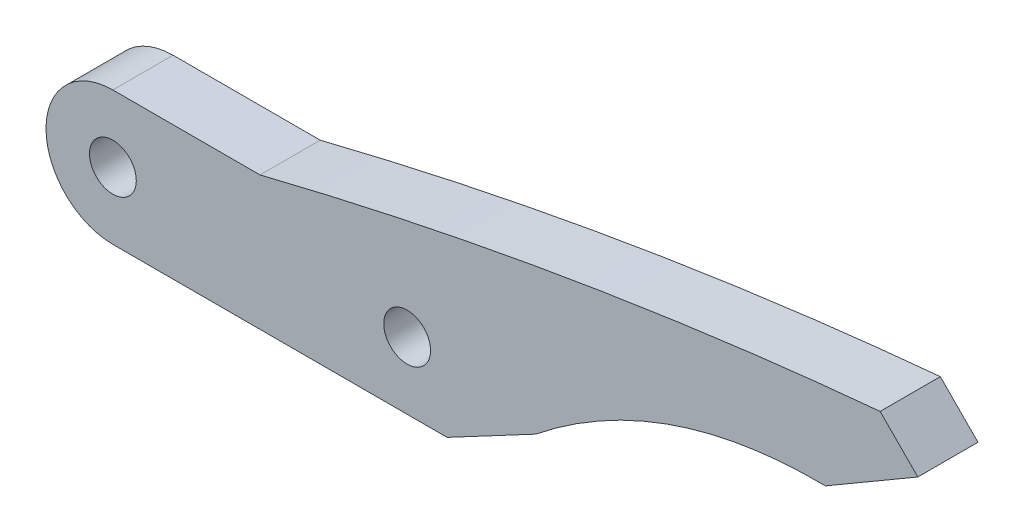
from build123d import *

# Parameters (mm, degrees)
SKETCH1_R           = 5
SKETCH1_R_2         = 1.75
BOSS_EXTRUDE1_DEPTH = 4.5
BOSS_EXTRUDE2_START = -4.5
BOSS_EXTRUDE2_DEPTH = 4.5


with BuildPart() as part:
    # Sketch1 → Boss-Extrude1 (new body)
    # profile 1 of 3: a face of its own
    with BuildSketch(Plane.XY):
        with Locations((-11, 0)):
            Circle(SKETCH1_R)
        with Locations((-11, 0)):
            Circle(SKETCH1_R_2, mode=Mode.SUBTRACT)
    # profile 2 of 3: a face of its own
    with BuildSketch(Plane.XY):
        with Locations((11, 0)):
            Circle(SKETCH1_R)
        with Locations((11, 0)):
            Circle(SKETCH1_R_2, mode=Mode.SUBTRACT)
    # profile 3 of 3: a face of its own
    with BuildSketch(Plane.XY):
        with BuildLine():
            ThreePointArc((-6, 0), (-7.464466094, -3.535533906), (-11, -5))
            Line((-11, -5), (11.000000019, -5))
            ThreePointArc((11.000000019, -5), (6, -9e-09), (11, 5))
            Line((11, 5), (-11, 5))
            ThreePointArc((-11, 5), (-7.464466094, 3.535533906), (-6, 0))
        make_face()
    extrude(amount=BOSS_EXTRUDE1_DEPTH)

    # Sketch2 → Boss-Extrude2 (add)
    with BuildSketch(Plane.XY.offset(4.5).offset(BOSS_EXTRUDE2_START)):
        with BuildLine():
            Line((49.180795902, 10.03), (46.363989199, 12.87))
            add(Edge.make_bspline(
                [(0, 5), (22.885517501, 10.707926651), (46.363989199, 12.87)],
                knots=[0, 0, 0, 1, 1, 1], degree=2))
            Line((0, 5), (11, 5))
            ThreePointArc((11, 5), (16, 0), (11, -5))
            Line((11, -5), (13.99, -5))
            Line((13.99, -5), (20.61, -1.48))
            add(Edge.make_bspline(
                [(42.27, 6), (30.146150748, 6.157348305), (20.61, -1.48)],
                knots=[0, 0, 0, 1, 1, 1], degree=2))
            Line((42.27, 6), (49.180795902, 10.03))
        make_face()
    extrude(amount=BOSS_EXTRUDE2_DEPTH)


solid = part.part
